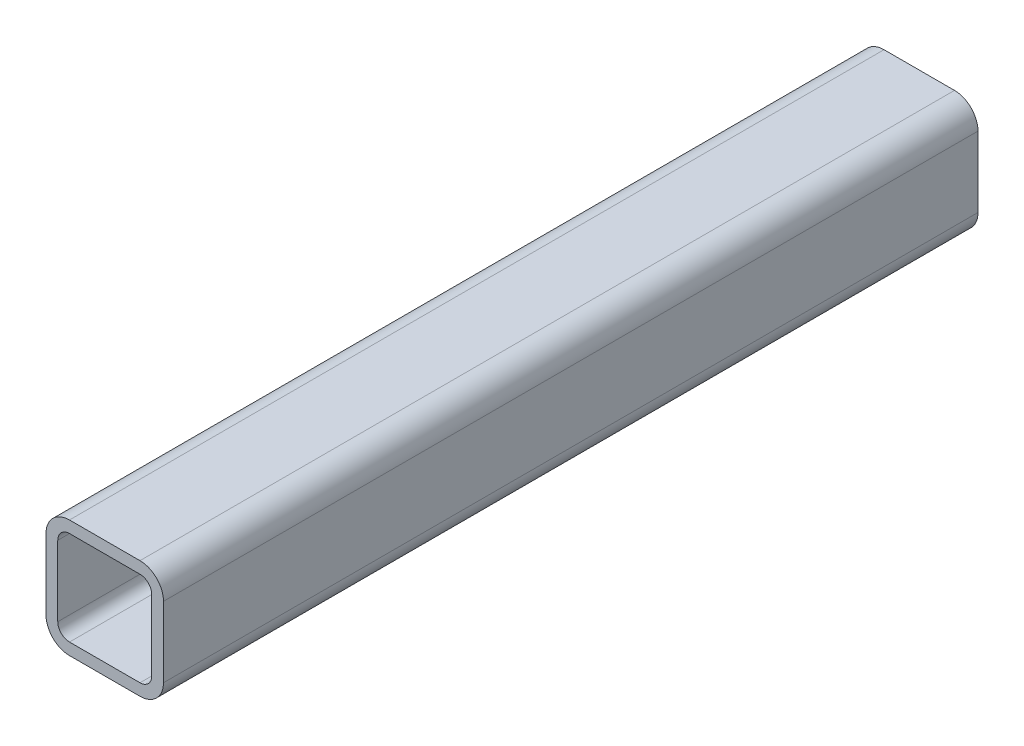
from build123d import *

# Parameters (mm, degrees)
EXTRUDE_1_DEPTH = 104


with BuildPart() as part:
    # Эскиз1 → Бобышка-Вытянуть1 (new, symmetric)
    with BuildSketch(Plane(origin=(0, 0, 0), x_dir=(-1, 0, 0), z_dir=(0, 0, -1))):
        with BuildLine():
            Line((-9, -15), (9, -15))
            ThreePointArc((9, -15), (13.242640687, -13.242640687), (15, -9))
            Line((15, -9), (15, 9))
            ThreePointArc((15, 9), (13.242640687, 13.242640687), (9, 15))
            Line((9, 15), (-9, 15))
            ThreePointArc((-9, 15), (-13.242640687, 13.242640687), (-15, 9))
            Line((-15, 9), (-15, -9))
            ThreePointArc((-15, -9), (-13.242640687, -13.242640687), (-9, -15))
        make_face()
        with BuildLine():
            Line((-9, 12), (9, 12))
            ThreePointArc((9, 12), (11.121320344, 11.121320344), (12, 9))
            Line((12, 9), (12, -9))
            ThreePointArc((12, -9), (11.121320344, -11.121320344), (9, -12))
            Line((9, -12), (-9, -12))
            ThreePointArc((-9, -12), (-11.121320344, -11.121320344), (-12, -9))
            Line((-12, -9), (-12, 9))
            ThreePointArc((-12, 9), (-11.121320344, 11.121320344), (-9, 12))
        make_face(mode=Mode.SUBTRACT)
    extrude(amount=EXTRUDE_1_DEPTH, both=True)


solid = part.part
